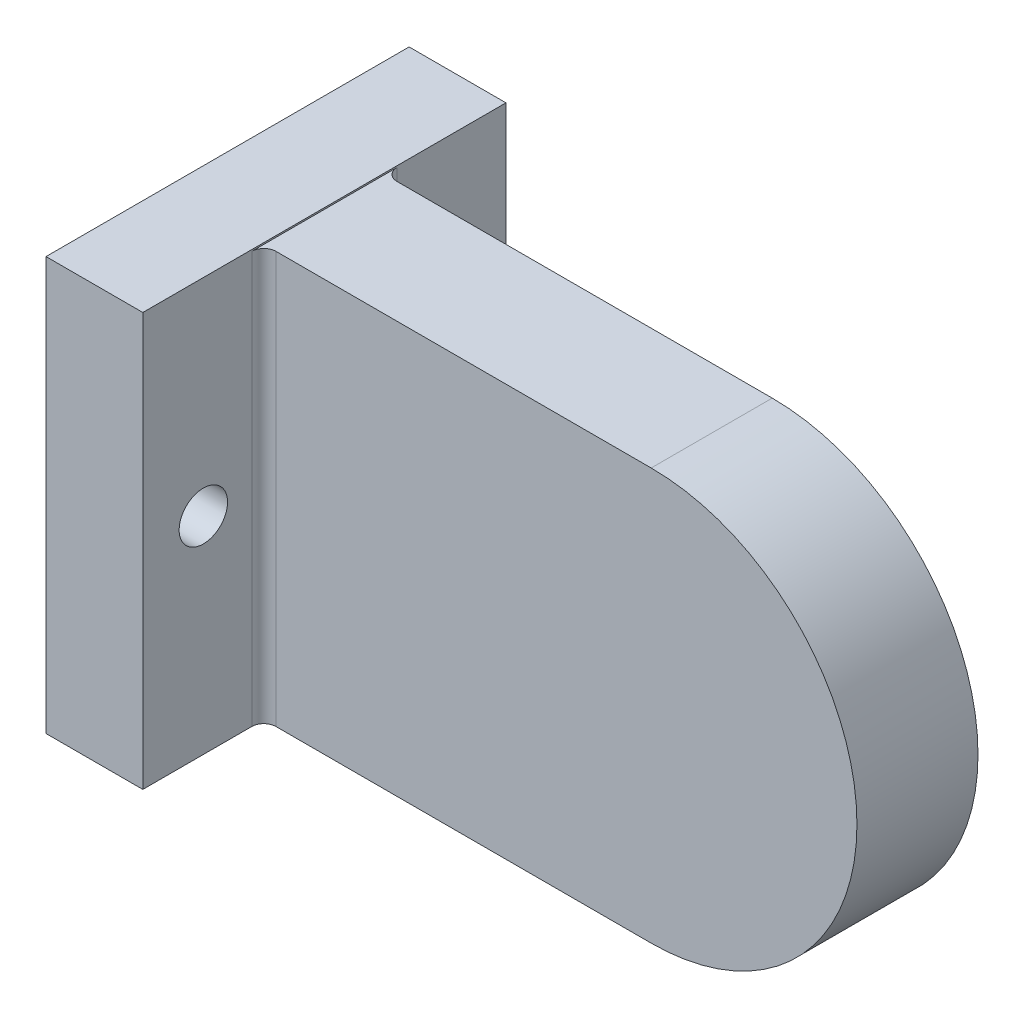
from build123d import *

# Parameters (mm, degrees)
BOSS_EXTRUDE1_DEPTH = 10
SKETCH3_W           = 30
SKETCH3_H           = 34.126910457
BOSS_EXTRUDE2_DEPTH = 8
FILLET1_R           = 1
SKETCH5_R           = 2
CUT_EXTRUDE2_DEPTH  = 63.999765085
SKETCH6_R           = 13.65
CUT_EXTRUDE3_DEPTH  = 8


with BuildPart() as part:
    # Sketch2 → Boss-Extrude1 (new body)
    with BuildSketch(Plane.XY):
        with BuildLine():
            Line((22.912878475, 16.112283523), (-17.087121525, 16.112283523))
            Line((-17.087121525, 16.112283523), (-17.087121525, -17.887716477))
            Line((-17.087121525, -17.887716477), (22.912878475, -17.887716477))
            ThreePointArc((22.912878475, -17.887716477), (39.912878475, -0.887716477), (22.912878475, 16.112283523))
        make_face()
    extrude(amount=BOSS_EXTRUDE1_DEPTH)

    # Sketch3 → Boss-Extrude2 (add)
    with BuildSketch(Plane.ZY.offset(17.087121525)):
        with Locations((5, -0.824261249)):
            Rectangle(SKETCH3_W, SKETCH3_H)
    extrude(amount=-BOSS_EXTRUDE2_DEPTH)

    # Fillet1
    fillet1_edges = [part.edges().sort_by_distance(p)[0] for p in [
        (-9.087121525, -0.887716477, 0),
        (-9.087121525, -0.887716477, 10),
    ]]
    fillet(fillet1_edges, radius=FILLET1_R)

    # Sketch5 → Cut-Extrude2 (cut, through all)
    with BuildSketch(Plane.ZY.offset(17.087121525)):
        with Locations(Location((-5, -0.824261249, 0), (0, 0, 270))):
            Circle(SKETCH5_R)
        with Locations(Location((15, -0.824261249, 0), (0, 0, 270))):
            Circle(SKETCH5_R)
    extrude(amount=-CUT_EXTRUDE2_DEPTH, mode=Mode.SUBTRACT)

    # Sketch6 → Cut-Extrude3 (cut)
    with BuildSketch(Plane(origin=(0, 0, 0), x_dir=(-1, 0, 0), z_dir=(0, 0, -1))):
        with Locations((-22.912878475, -0.887716477)):
            Circle(SKETCH6_R)
    extrude(amount=-CUT_EXTRUDE3_DEPTH, mode=Mode.SUBTRACT)


solid = part.part
